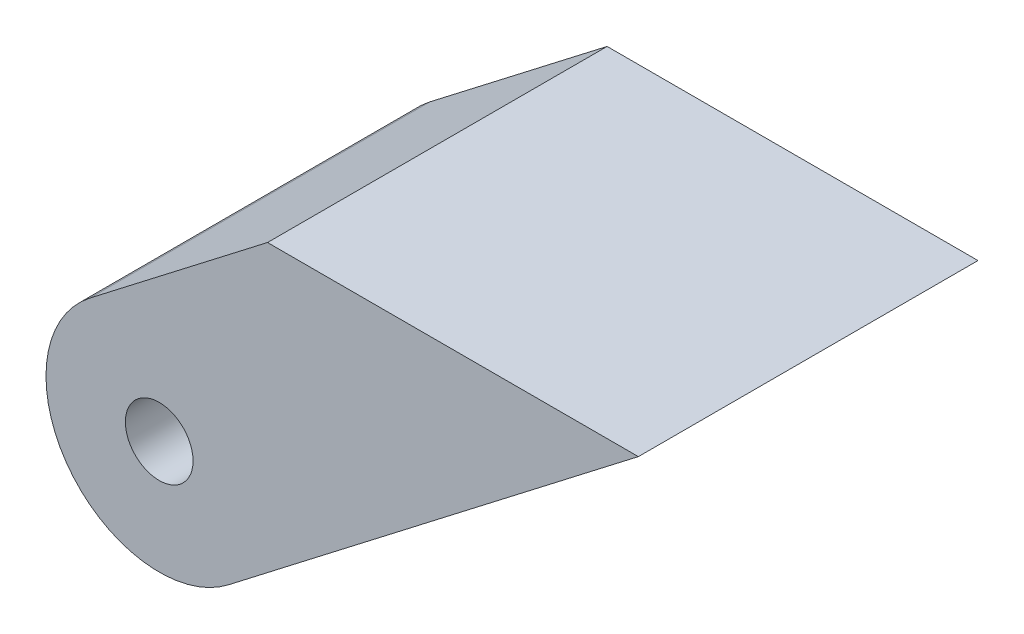
from build123d import *

# Parameters (mm, degrees)
BOSS_EXTRUDE1_DEPTH   = 19.05
F_6_CLEARANCE_HOLE1_D = 3.7973


with BuildPart() as part:
    # Sketch1 → Boss-Extrude1 (new body)
    with BuildSketch(Plane.XY):
        with BuildLine():
            Line((6.074664, 12.7), (-3.876684639, 5.029295797))
            ThreePointArc((-3.876684639, 5.029295797), (-5.029295797, -3.876684639), (3.876684639, -5.029295797))
            Line((3.876684639, -5.029295797), (26.877233079, 12.7))
            Line((26.877233079, 12.7), (6.074664, 12.7))
        make_face()
    extrude(amount=BOSS_EXTRUDE1_DEPTH)

    # #6 Clearance Hole1 (through all)
    with Locations(Plane.XY.offset(19.05)):
        with Locations((0, 0)):
            Hole(F_6_CLEARANCE_HOLE1_D / 2)


solid = part.part
